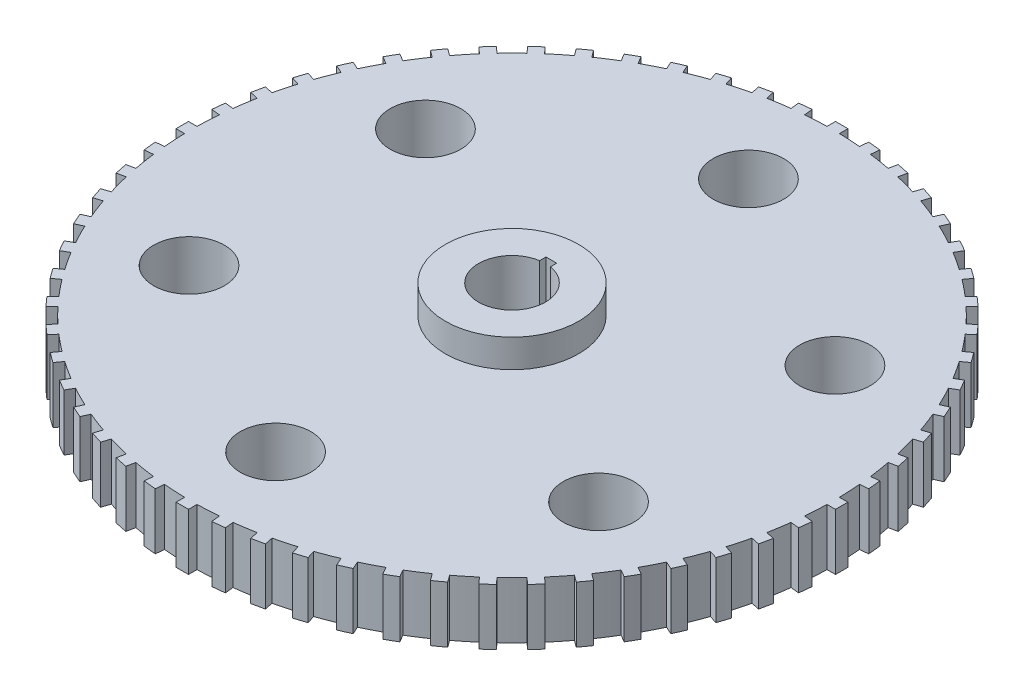
from build123d import *

# Parameters (mm, degrees)
BOSS_EXTRUDE4_DEPTH = 12.7
SKETCH2_R           = 14.986
BOSS_EXTRUDE5_DEPTH = 6.35
SKETCH3_R           = 7.9375
CUT_EXTRUDE1_DEPTH  = 12.7


with BuildPart() as part:
    # Sketch1 → Boss-Extrude4 (new body)
    with BuildSketch(Plane(origin=(0, 0, 0), x_dir=(1, 0, 0), z_dir=(0, 1, 0))):
        with BuildLine():
            ThreePointArc((-6.16278162, -71.999731192), (-3.781953206, -72.16396607), (-1.397, -72.249495223))
            Line((-1.397, -72.249495223), (-1.397, -74.154842155))
            ThreePointArc((-1.397, -74.154842155), (0, -74.168), (1.397, -74.154842155))
            Line((1.397, -74.154842155), (1.397, -72.249495223))
            ThreePointArc((1.397, -72.249495223), (3.781953206, -72.16396607), (6.16278162, -71.999731192))
            Line((6.16278162, -71.999731192), (6.361944606, -73.894640434))
            ThreePointArc((6.361944606, -73.894640434), (7.752667064, -73.761699936), (9.140638782, -73.602587907))
            Line((9.140638782, -73.602587907), (8.941475795, -71.707678666))
            ThreePointArc((8.941475795, -71.707678666), (11.304423747, -71.373322556), (13.655042514, -70.961123039))
            Line((13.655042514, -70.961123039), (14.051186416, -72.824833569))
            ThreePointArc((14.051186416, -72.824833569), (15.420394285, -72.547251251), (16.784130813, -72.243928304))
            Line((16.784130813, -72.243928304), (16.387986911, -70.380217775))
            ThreePointArc((16.387986911, -70.380217775), (18.703040656, -69.800697985), (20.997695906, -69.145049972))
            Line((20.997695906, -69.145049972), (21.586480488, -70.957142587))
            ThreePointArc((21.586480488, -70.957142587), (22.919172439, -70.537959701), (24.243732394, -70.093749105))
            Line((24.243732394, -70.093749105), (23.654947812, -68.28165649))
            ThreePointArc((23.654947812, -68.28165649), (25.896743138, -67.46332236), (28.110294147, -66.571409268))
            Line((28.110294147, -66.571409268), (28.885268562, -68.312030303))
            ThreePointArc((28.885268562, -68.312030303), (30.166843344, -67.755839502), (31.43771457, -67.175608122))
            Line((31.43771457, -67.175608122), (30.662740155, -65.434987088))
            ThreePointArc((30.662740155, -65.434987088), (32.806715483, -64.386804457), (34.914910122, -63.268398274))
            Line((34.914910122, -63.268398274), (35.867583588, -64.91847712))
            ThreePointArc((35.867583588, -64.91847712), (37.084, -64.231372148), (38.287258566, -63.52147712))
            Line((38.287258566, -63.52147712), (37.334585101, -61.871398274))
            ThreePointArc((37.334585101, -61.871398274), (39.357250587, -60.604851251), (41.336991037, -59.272205468))
            Line((41.336991037, -59.272205468), (42.456925864, -60.813663516))
            ThreePointArc((42.456925864, -60.813663516), (43.594856592, -60.003172439), (44.717319346, -59.171391521))
            Line((44.717319346, -59.171391521), (43.597384519, -57.629933473))
            ThreePointArc((43.597384519, -57.629933473), (45.476579418, -56.158898613), (47.306175227, -54.626613976))
            Line((47.306175227, -54.626613976), (48.581101174, -56.042562688))
            ThreePointArc((48.581101174, -56.042562688), (49.628078812, -55.117565416), (50.657447817, -54.173011774))
            Line((50.657447817, -54.173011774), (49.382521869, -52.757063061))
            ThreePointArc((49.382521869, -52.757063061), (51.097657329, -51.097657329), (52.757063061, -49.382521869))
            Line((52.757063061, -49.382521869), (54.173011774, -50.657447817))
            ThreePointArc((54.173011774, -50.657447817), (55.117565416, -49.628078812), (56.042562688, -48.581101174))
            Line((56.042562688, -48.581101174), (54.626613976, -47.306175227))
            ThreePointArc((54.626613976, -47.306175227), (56.158898613, -45.476579418), (57.629933473, -43.597384519))
            Line((57.629933473, -43.597384519), (59.171391521, -44.717319346))
            ThreePointArc((59.171391521, -44.717319346), (60.003172439, -43.594856592), (60.813663516, -42.456925864))
            Line((60.813663516, -42.456925864), (59.272205468, -41.336991037))
            ThreePointArc((59.272205468, -41.336991037), (60.604851251, -39.357250587), (61.871398274, -37.334585101))
            Line((61.871398274, -37.334585101), (63.52147712, -38.287258566))
            ThreePointArc((63.52147712, -38.287258566), (64.231372148, -37.084), (64.91847712, -35.867583588))
            Line((64.91847712, -35.867583588), (63.268398274, -34.914910122))
            ThreePointArc((63.268398274, -34.914910122), (64.386804457, -32.806715483), (65.434987088, -30.662740155))
            Line((65.434987088, -30.662740155), (67.175608122, -31.43771457))
            ThreePointArc((67.175608122, -31.43771457), (67.755839502, -30.166843344), (68.312030303, -28.885268562))
            Line((68.312030303, -28.885268562), (66.571409268, -28.110294147))
            ThreePointArc((66.571409268, -28.110294147), (67.46332236, -25.896743138), (68.28165649, -23.654947812))
            Line((68.28165649, -23.654947812), (70.093749105, -24.243732394))
            ThreePointArc((70.093749105, -24.243732394), (70.537959701, -22.919172439), (70.957142587, -21.586480488))
            Line((70.957142587, -21.586480488), (69.145049972, -20.997695906))
            ThreePointArc((69.145049972, -20.997695906), (69.800697985, -18.703040656), (70.380217775, -16.387986911))
            Line((70.380217775, -16.387986911), (72.243928304, -16.784130813))
            ThreePointArc((72.243928304, -16.784130813), (72.547251251, -15.420394285), (72.824833569, -14.051186416))
            Line((72.824833569, -14.051186416), (70.961123039, -13.655042514))
            ThreePointArc((70.961123039, -13.655042514), (71.373322556, -11.304423747), (71.707678666, -8.941475795))
            Line((71.707678666, -8.941475795), (73.602587907, -9.140638782))
            ThreePointArc((73.602587907, -9.140638782), (73.761699936, -7.752667064), (73.894640434, -6.361944606))
            Line((73.894640434, -6.361944606), (71.999731192, -6.16278162))
            ThreePointArc((71.999731192, -6.16278162), (72.16396607, -3.781953206), (72.249495223, -1.397))
            Line((72.249495223, -1.397), (74.154842155, -1.397))
            ThreePointArc((74.154842155, -1.397), (74.168, 0), (74.154842155, 1.397))
            Line((74.154842155, 1.397), (72.249495223, 1.397))
            ThreePointArc((72.249495223, 1.397), (72.16396607, 3.781953206), (71.999731192, 6.16278162))
            Line((71.999731192, 6.16278162), (73.894640434, 6.361944606))
            ThreePointArc((73.894640434, 6.361944606), (73.761699936, 7.752667064), (73.602587907, 9.140638782))
            Line((73.602587907, 9.140638782), (71.707678666, 8.941475795))
            ThreePointArc((71.707678666, 8.941475795), (71.373322556, 11.304423747), (70.961123039, 13.655042514))
            Line((70.961123039, 13.655042514), (72.824833569, 14.051186416))
            ThreePointArc((72.824833569, 14.051186416), (72.547251251, 15.420394285), (72.243928304, 16.784130813))
            Line((72.243928304, 16.784130813), (70.380217775, 16.387986911))
            ThreePointArc((70.380217775, 16.387986911), (69.800697985, 18.703040656), (69.145049972, 20.997695906))
            Line((69.145049972, 20.997695906), (70.957142587, 21.586480488))
            ThreePointArc((70.957142587, 21.586480488), (70.537959701, 22.919172439), (70.093749105, 24.243732394))
            Line((70.093749105, 24.243732394), (68.28165649, 23.654947812))
            ThreePointArc((68.28165649, 23.654947812), (67.46332236, 25.896743138), (66.571409268, 28.110294147))
            Line((66.571409268, 28.110294147), (68.312030303, 28.885268562))
            ThreePointArc((68.312030303, 28.885268562), (67.755839502, 30.166843344), (67.175608122, 31.43771457))
            Line((67.175608122, 31.43771457), (65.434987088, 30.662740155))
            ThreePointArc((65.434987088, 30.662740155), (64.386804457, 32.806715483), (63.268398274, 34.914910122))
            Line((63.268398274, 34.914910122), (64.91847712, 35.867583588))
            ThreePointArc((64.91847712, 35.867583588), (64.231372148, 37.084), (63.52147712, 38.287258566))
            Line((63.52147712, 38.287258566), (61.871398274, 37.334585101))
            ThreePointArc((61.871398274, 37.334585101), (60.604851251, 39.357250587), (59.272205468, 41.336991037))
            Line((59.272205468, 41.336991037), (60.813663516, 42.456925864))
            ThreePointArc((60.813663516, 42.456925864), (60.003172439, 43.594856592), (59.171391521, 44.717319346))
            Line((59.171391521, 44.717319346), (57.629933473, 43.597384519))
            ThreePointArc((57.629933473, 43.597384519), (56.158898613, 45.476579418), (54.626613976, 47.306175227))
            Line((54.626613976, 47.306175227), (56.042562688, 48.581101174))
            ThreePointArc((56.042562688, 48.581101174), (55.117565416, 49.628078812), (54.173011774, 50.657447817))
            Line((54.173011774, 50.657447817), (52.757063061, 49.382521869))
            ThreePointArc((52.757063061, 49.382521869), (51.097657329, 51.097657329), (49.382521869, 52.757063061))
            Line((49.382521869, 52.757063061), (50.657447817, 54.173011774))
            ThreePointArc((50.657447817, 54.173011774), (49.628078812, 55.117565416), (48.581101174, 56.042562688))
            Line((48.581101174, 56.042562688), (47.306175227, 54.626613976))
            ThreePointArc((47.306175227, 54.626613976), (45.476579418, 56.158898613), (43.597384519, 57.629933473))
            Line((43.597384519, 57.629933473), (44.717319346, 59.171391521))
            ThreePointArc((44.717319346, 59.171391521), (43.594856592, 60.003172439), (42.456925864, 60.813663516))
            Line((42.456925864, 60.813663516), (41.336991037, 59.272205468))
            ThreePointArc((41.336991037, 59.272205468), (39.357250587, 60.604851251), (37.334585101, 61.871398274))
            Line((37.334585101, 61.871398274), (38.287258566, 63.52147712))
            ThreePointArc((38.287258566, 63.52147712), (37.084, 64.231372148), (35.867583588, 64.91847712))
            Line((35.867583588, 64.91847712), (34.914910122, 63.268398274))
            ThreePointArc((34.914910122, 63.268398274), (32.806715483, 64.386804457), (30.662740155, 65.434987088))
            Line((30.662740155, 65.434987088), (31.43771457, 67.175608122))
            ThreePointArc((31.43771457, 67.175608122), (30.166843344, 67.755839502), (28.885268562, 68.312030303))
            Line((28.885268562, 68.312030303), (28.110294147, 66.571409268))
            ThreePointArc((28.110294147, 66.571409268), (25.896743138, 67.46332236), (23.654947812, 68.28165649))
            Line((23.654947812, 68.28165649), (24.243732394, 70.093749105))
            ThreePointArc((24.243732394, 70.093749105), (22.919172439, 70.537959701), (21.586480488, 70.957142587))
            Line((21.586480488, 70.957142587), (20.997695906, 69.145049972))
            ThreePointArc((20.997695906, 69.145049972), (18.703040656, 69.800697985), (16.387986911, 70.380217775))
            Line((16.387986911, 70.380217775), (16.784130813, 72.243928304))
            ThreePointArc((16.784130813, 72.243928304), (15.420394285, 72.547251251), (14.051186416, 72.824833569))
            Line((14.051186416, 72.824833569), (13.655042514, 70.961123039))
            ThreePointArc((13.655042514, 70.961123039), (11.304423747, 71.373322556), (8.941475795, 71.707678666))
            Line((8.941475795, 71.707678666), (9.140638782, 73.602587907))
            ThreePointArc((9.140638782, 73.602587907), (7.752667064, 73.761699936), (6.361944606, 73.894640434))
            Line((6.361944606, 73.894640434), (6.16278162, 71.999731192))
            ThreePointArc((6.16278162, 71.999731192), (3.781953206, 72.16396607), (1.397, 72.249495223))
            Line((1.397, 72.249495223), (1.397, 74.154842155))
            ThreePointArc((1.397, 74.154842155), (0, 74.168), (-1.397, 74.154842155))
            Line((-1.397, 74.154842155), (-1.397, 72.249495223))
            ThreePointArc((-1.397, 72.249495223), (-3.781953206, 72.16396607), (-6.16278162, 71.999731192))
            Line((-6.16278162, 71.999731192), (-6.361944606, 73.894640434))
            ThreePointArc((-6.361944606, 73.894640434), (-7.752667064, 73.761699936), (-9.140638782, 73.602587907))
            Line((-9.140638782, 73.602587907), (-8.941475795, 71.707678666))
            ThreePointArc((-8.941475795, 71.707678666), (-11.304423747, 71.373322556), (-13.655042514, 70.961123039))
            Line((-13.655042514, 70.961123039), (-14.051186416, 72.824833569))
            ThreePointArc((-14.051186416, 72.824833569), (-15.420394285, 72.547251251), (-16.784130813, 72.243928304))
            Line((-16.784130813, 72.243928304), (-16.387986911, 70.380217775))
            ThreePointArc((-16.387986911, 70.380217775), (-18.703040656, 69.800697985), (-20.997695906, 69.145049972))
            Line((-20.997695906, 69.145049972), (-21.586480488, 70.957142587))
            ThreePointArc((-21.586480488, 70.957142587), (-22.919172439, 70.537959701), (-24.243732394, 70.093749105))
            Line((-24.243732394, 70.093749105), (-23.654947812, 68.28165649))
            ThreePointArc((-23.654947812, 68.28165649), (-25.896743138, 67.46332236), (-28.110294147, 66.571409268))
            Line((-28.110294147, 66.571409268), (-28.885268562, 68.312030303))
            ThreePointArc((-28.885268562, 68.312030303), (-30.166843344, 67.755839502), (-31.43771457, 67.175608122))
            Line((-31.43771457, 67.175608122), (-30.662740155, 65.434987088))
            ThreePointArc((-30.662740155, 65.434987088), (-32.806715483, 64.386804457), (-34.914910122, 63.268398274))
            Line((-34.914910122, 63.268398274), (-35.867583588, 64.91847712))
            ThreePointArc((-35.867583588, 64.91847712), (-37.084, 64.231372148), (-38.287258566, 63.52147712))
            Line((-38.287258566, 63.52147712), (-37.334585101, 61.871398274))
            ThreePointArc((-37.334585101, 61.871398274), (-39.357250587, 60.604851251), (-41.336991037, 59.272205468))
            Line((-41.336991037, 59.272205468), (-42.456925864, 60.813663516))
            ThreePointArc((-42.456925864, 60.813663516), (-43.594856592, 60.003172439), (-44.717319346, 59.171391521))
            Line((-44.717319346, 59.171391521), (-43.597384519, 57.629933473))
            ThreePointArc((-43.597384519, 57.629933473), (-45.476579418, 56.158898613), (-47.306175227, 54.626613976))
            Line((-47.306175227, 54.626613976), (-48.581101174, 56.042562688))
            ThreePointArc((-48.581101174, 56.042562688), (-49.628078812, 55.117565416), (-50.657447817, 54.173011774))
            Line((-50.657447817, 54.173011774), (-49.382521869, 52.757063061))
            ThreePointArc((-49.382521869, 52.757063061), (-51.097657329, 51.097657329), (-52.757063061, 49.382521869))
            Line((-52.757063061, 49.382521869), (-54.173011774, 50.657447817))
            ThreePointArc((-54.173011774, 50.657447817), (-55.117565416, 49.628078812), (-56.042562688, 48.581101174))
            Line((-56.042562688, 48.581101174), (-54.626613976, 47.306175227))
            ThreePointArc((-54.626613976, 47.306175227), (-56.158898613, 45.476579418), (-57.629933473, 43.597384519))
            Line((-57.629933473, 43.597384519), (-59.171391521, 44.717319346))
            ThreePointArc((-59.171391521, 44.717319346), (-60.003172439, 43.594856592), (-60.813663516, 42.456925864))
            Line((-60.813663516, 42.456925864), (-59.272205468, 41.336991037))
            ThreePointArc((-59.272205468, 41.336991037), (-60.604851251, 39.357250587), (-61.871398274, 37.334585101))
            Line((-61.871398274, 37.334585101), (-63.52147712, 38.287258566))
            ThreePointArc((-63.52147712, 38.287258566), (-64.231372148, 37.084), (-64.91847712, 35.867583588))
            Line((-64.91847712, 35.867583588), (-63.268398274, 34.914910122))
            ThreePointArc((-63.268398274, 34.914910122), (-64.386804457, 32.806715483), (-65.434987088, 30.662740155))
            Line((-65.434987088, 30.662740155), (-67.175608122, 31.43771457))
            ThreePointArc((-67.175608122, 31.43771457), (-67.755839502, 30.166843344), (-68.312030303, 28.885268562))
            Line((-68.312030303, 28.885268562), (-66.571409268, 28.110294147))
            ThreePointArc((-66.571409268, 28.110294147), (-67.46332236, 25.896743138), (-68.28165649, 23.654947812))
            Line((-68.28165649, 23.654947812), (-70.093749105, 24.243732394))
            ThreePointArc((-70.093749105, 24.243732394), (-70.537959701, 22.919172439), (-70.957142587, 21.586480488))
            Line((-70.957142587, 21.586480488), (-69.145049972, 20.997695906))
            ThreePointArc((-69.145049972, 20.997695906), (-69.800697985, 18.703040656), (-70.380217775, 16.387986911))
            Line((-70.380217775, 16.387986911), (-72.243928304, 16.784130813))
            ThreePointArc((-72.243928304, 16.784130813), (-72.547251251, 15.420394285), (-72.824833569, 14.051186416))
            Line((-72.824833569, 14.051186416), (-70.961123039, 13.655042514))
            ThreePointArc((-70.961123039, 13.655042514), (-71.373322556, 11.304423747), (-71.707678666, 8.941475795))
            Line((-71.707678666, 8.941475795), (-73.602587907, 9.140638782))
            ThreePointArc((-73.602587907, 9.140638782), (-73.761699936, 7.752667064), (-73.894640434, 6.361944606))
            Line((-73.894640434, 6.361944606), (-71.999731192, 6.16278162))
            ThreePointArc((-71.999731192, 6.16278162), (-72.16396607, 3.781953206), (-72.249495223, 1.397))
            Line((-72.249495223, 1.397), (-74.154842155, 1.397))
            ThreePointArc((-74.154842155, 1.397), (-74.168, 0), (-74.154842155, -1.397))
            Line((-74.154842155, -1.397), (-72.249495223, -1.397))
            ThreePointArc((-72.249495223, -1.397), (-72.16396607, -3.781953206), (-71.999731192, -6.16278162))
            Line((-71.999731192, -6.16278162), (-73.894640434, -6.361944606))
            ThreePointArc((-73.894640434, -6.361944606), (-73.761699936, -7.752667064), (-73.602587907, -9.140638782))
            Line((-73.602587907, -9.140638782), (-71.707678666, -8.941475795))
            ThreePointArc((-71.707678666, -8.941475795), (-71.373322556, -11.304423747), (-70.961123039, -13.655042514))
            Line((-70.961123039, -13.655042514), (-72.824833569, -14.051186416))
            ThreePointArc((-72.824833569, -14.051186416), (-72.547251251, -15.420394285), (-72.243928304, -16.784130813))
            Line((-72.243928304, -16.784130813), (-70.380217775, -16.387986911))
            ThreePointArc((-70.380217775, -16.387986911), (-69.800697985, -18.703040656), (-69.145049972, -20.997695906))
            Line((-69.145049972, -20.997695906), (-70.957142587, -21.586480488))
            ThreePointArc((-70.957142587, -21.586480488), (-70.537959701, -22.919172439), (-70.093749105, -24.243732394))
            Line((-70.093749105, -24.243732394), (-68.28165649, -23.654947812))
            ThreePointArc((-68.28165649, -23.654947812), (-67.46332236, -25.896743138), (-66.571409268, -28.110294147))
            Line((-66.571409268, -28.110294147), (-68.312030303, -28.885268562))
            ThreePointArc((-68.312030303, -28.885268562), (-67.755839502, -30.166843344), (-67.175608122, -31.43771457))
            Line((-67.175608122, -31.43771457), (-65.434987088, -30.662740155))
            ThreePointArc((-65.434987088, -30.662740155), (-64.386804457, -32.806715483), (-63.268398274, -34.914910122))
            Line((-63.268398274, -34.914910122), (-64.91847712, -35.867583588))
            ThreePointArc((-64.91847712, -35.867583588), (-64.231372148, -37.084), (-63.52147712, -38.287258566))
            Line((-63.52147712, -38.287258566), (-61.871398274, -37.334585101))
            ThreePointArc((-61.871398274, -37.334585101), (-60.604851251, -39.357250587), (-59.272205468, -41.336991037))
            Line((-59.272205468, -41.336991037), (-60.813663516, -42.456925864))
            ThreePointArc((-60.813663516, -42.456925864), (-60.003172439, -43.594856592), (-59.171391521, -44.717319346))
            Line((-59.171391521, -44.717319346), (-57.629933473, -43.597384519))
            ThreePointArc((-57.629933473, -43.597384519), (-56.158898613, -45.476579418), (-54.626613976, -47.306175227))
            Line((-54.626613976, -47.306175227), (-56.042562688, -48.581101174))
            ThreePointArc((-56.042562688, -48.581101174), (-55.117565416, -49.628078812), (-54.173011774, -50.657447817))
            Line((-54.173011774, -50.657447817), (-52.757063061, -49.382521869))
            ThreePointArc((-52.757063061, -49.382521869), (-51.097657329, -51.097657329), (-49.382521869, -52.757063061))
            Line((-49.382521869, -52.757063061), (-50.657447817, -54.173011774))
            ThreePointArc((-50.657447817, -54.173011774), (-49.628078812, -55.117565416), (-48.581101174, -56.042562688))
            Line((-48.581101174, -56.042562688), (-47.306175227, -54.626613976))
            ThreePointArc((-47.306175227, -54.626613976), (-45.476579418, -56.158898613), (-43.597384519, -57.629933473))
            Line((-43.597384519, -57.629933473), (-44.717319346, -59.171391521))
            ThreePointArc((-44.717319346, -59.171391521), (-43.594856592, -60.003172439), (-42.456925864, -60.813663516))
            Line((-42.456925864, -60.813663516), (-41.336991037, -59.272205468))
            ThreePointArc((-41.336991037, -59.272205468), (-39.357250587, -60.604851251), (-37.334585101, -61.871398274))
            Line((-37.334585101, -61.871398274), (-38.287258566, -63.52147712))
            ThreePointArc((-38.287258566, -63.52147712), (-37.084, -64.231372148), (-35.867583588, -64.91847712))
            Line((-35.867583588, -64.91847712), (-34.914910122, -63.268398274))
            ThreePointArc((-34.914910122, -63.268398274), (-32.806715483, -64.386804457), (-30.662740155, -65.434987088))
            Line((-30.662740155, -65.434987088), (-31.43771457, -67.175608122))
            ThreePointArc((-31.43771457, -67.175608122), (-30.166843344, -67.755839502), (-28.885268562, -68.312030303))
            Line((-28.885268562, -68.312030303), (-28.110294147, -66.571409268))
            ThreePointArc((-28.110294147, -66.571409268), (-25.896743138, -67.46332236), (-23.654947812, -68.28165649))
            Line((-23.654947812, -68.28165649), (-24.243732394, -70.093749105))
            ThreePointArc((-24.243732394, -70.093749105), (-22.919172439, -70.537959701), (-21.586480488, -70.957142587))
            Line((-21.586480488, -70.957142587), (-20.997695906, -69.145049972))
            ThreePointArc((-20.997695906, -69.145049972), (-18.703040656, -69.800697985), (-16.387986911, -70.380217775))
            Line((-16.387986911, -70.380217775), (-16.784130813, -72.243928304))
            ThreePointArc((-16.784130813, -72.243928304), (-15.420394285, -72.547251251), (-14.051186416, -72.824833569))
            Line((-14.051186416, -72.824833569), (-13.655042514, -70.961123039))
            ThreePointArc((-13.655042514, -70.961123039), (-11.304423747, -71.373322556), (-8.941475795, -71.707678666))
            Line((-8.941475795, -71.707678666), (-9.140638782, -73.602587907))
            ThreePointArc((-9.140638782, -73.602587907), (-7.752667064, -73.761699936), (-6.361944606, -73.894640434))
            Line((-6.361944606, -73.894640434), (-6.16278162, -71.999731192))
        make_face()
        with BuildLine():
            Line((-1.2065, -7.5311), (-1.2065, -7.433829764))
            ThreePointArc((-1.2065, -7.433829764), (-7.5311, 0), (-1.2065, 7.433829764))
            Line((-1.2065, 7.433829764), (-1.2065, 8.8519))
            Line((-1.2065, 8.8519), (1.2065, 8.8519))
            Line((1.2065, 8.8519), (1.2065, 7.433829764))
            ThreePointArc((1.2065, 7.433829764), (7.5311, 0), (1.2065, -7.433829764))
            Line((1.2065, -7.433829764), (1.2065, -7.5311))
            Line((1.2065, -7.5311), (0, -7.5311))
            Line((0, -7.5311), (-1.2065, -7.5311))
        make_face(mode=Mode.SUBTRACT)
    extrude(amount=BOSS_EXTRUDE4_DEPTH)

    # Sketch2 → Boss-Extrude5 (add)
    with BuildSketch(Plane(origin=(0, 12.7, 0), x_dir=(1, 0, 0), z_dir=(0, 1, 0))):
        with Locations(Location((0, 0, 0), (0, 0, 270))):
            Circle(SKETCH2_R)
        with BuildLine():
            Line((-1.2065, 7.433829764), (-1.2065, 8.8519))
            Line((-1.2065, 8.8519), (1.2065, 8.8519))
            Line((1.2065, 8.8519), (1.2065, 7.433829764))
            ThreePointArc((1.2065, 7.433829764), (0, -7.5311), (-1.2065, 7.433829764))
        make_face(mode=Mode.SUBTRACT)
    extrude(amount=BOSS_EXTRUDE5_DEPTH)

    # Sketch3 → Cut-Extrude1 (cut)
    with BuildSketch(Plane(origin=(0, 12.7, 0), x_dir=(1, 0, 0), z_dir=(0, 1, 0))):
        with Locations(Location((0, 53.1876, 0), (0, 0, 270))):
            Circle(SKETCH3_R)
        with Locations(Location((46.061812766, 26.5938, 0), (0, 0, 270))):
            Circle(SKETCH3_R)
        with Locations(Location((46.061812766, -26.5938, 0), (0, 0, 270))):
            Circle(SKETCH3_R)
        with Locations(Location((0, -53.1876, 0), (0, 0, 270))):
            Circle(SKETCH3_R)
        with Locations(Location((-46.061812766, -26.5938, 0), (0, 0, 270))):
            Circle(SKETCH3_R)
        with Locations(Location((-46.061812766, 26.5938, 0), (0, 0, 270))):
            Circle(SKETCH3_R)
    extrude(amount=-CUT_EXTRUDE1_DEPTH, mode=Mode.SUBTRACT)


solid = part.part
